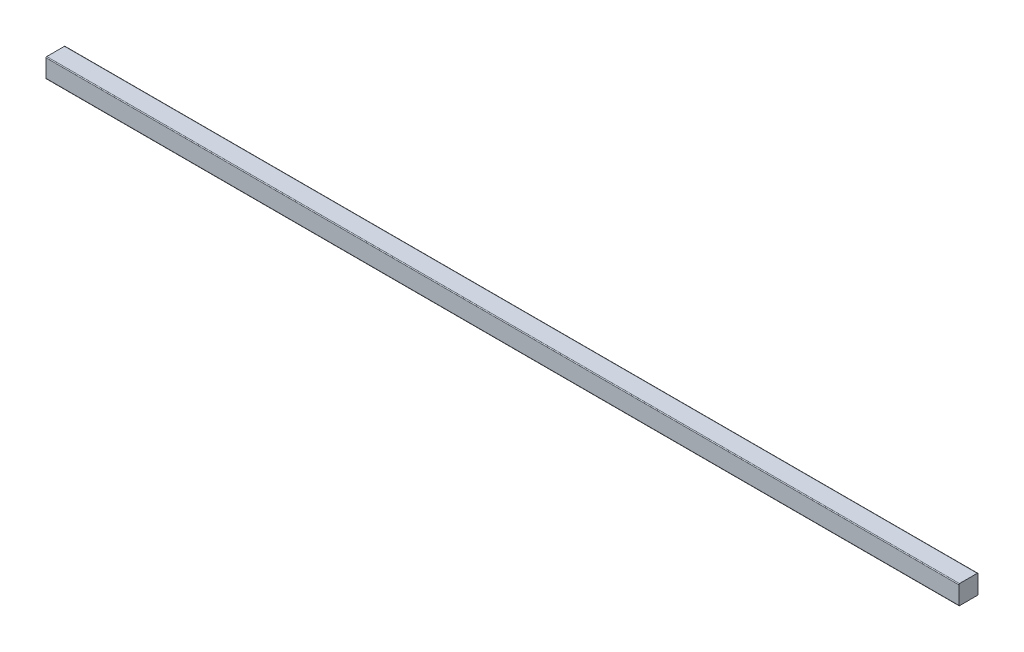
from build123d import *

# Parameters (mm, degrees)
SKETCH1_W           = 6.35
SKETCH1_H           = 6.35
BOSS_EXTRUDE1_DEPTH = 301.625
FILLET1_R           = 0.254


with BuildPart() as part:
    # Sketch1 → Boss-Extrude1 (new body)
    with BuildSketch(Plane(origin=(0, 0, 0), x_dir=(0, 0, -1), z_dir=(1, 0, 0))):
        Rectangle(SKETCH1_W, SKETCH1_H)
    extrude(amount=BOSS_EXTRUDE1_DEPTH)

    # Fillet1
    fillet1_edges = [part.edges().sort_by_distance(p)[0] for p in [
        (150.8125, -3.175, -3.175),
        (150.8125, -3.175, 3.175),
        (150.8125, 3.175, 3.175),
        (150.8125, 3.175, -3.175),
    ]]
    fillet(fillet1_edges, radius=FILLET1_R)


solid = part.part
